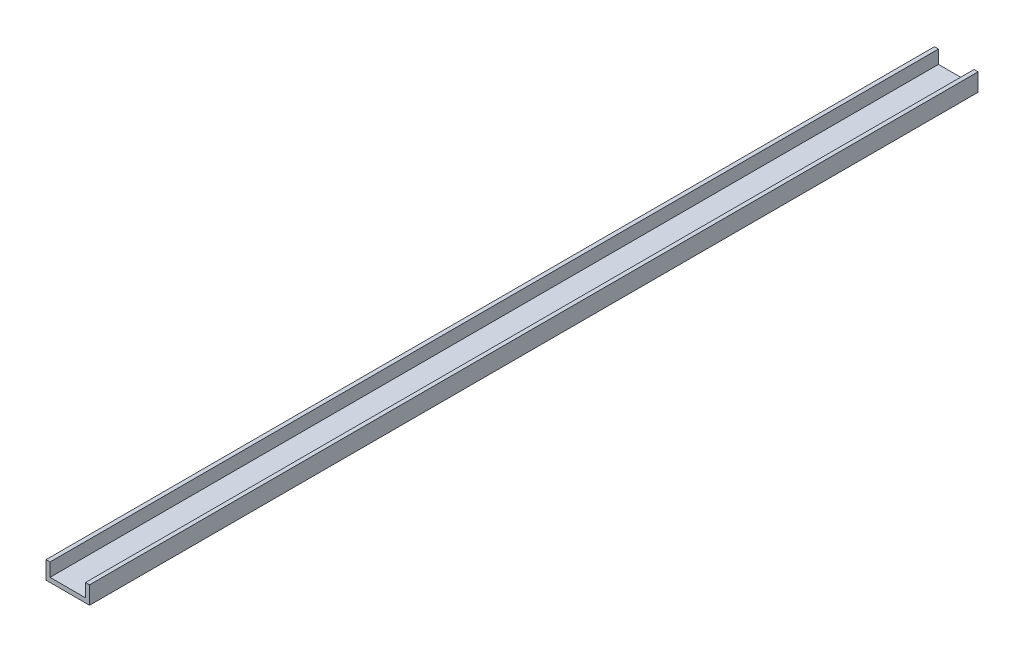
from build123d import *

# Parameters (mm, degrees)
BOSS_EXTRUDE1_DEPTH = 1000


with BuildPart() as part:
    # Sketch1 → Boss-Extrude1 (new body)
    with BuildSketch(Plane.XY):
        Polygon((-41.525952088, 0), (-1.525952088, 0), (-1.525952088, 15), (2.974047912, 15), (2.974047912, -5), (-46.025952088, -5), (-46.025952088, 15), (-41.525952088, 15), align=None)
    extrude(amount=BOSS_EXTRUDE1_DEPTH)


solid = part.part
